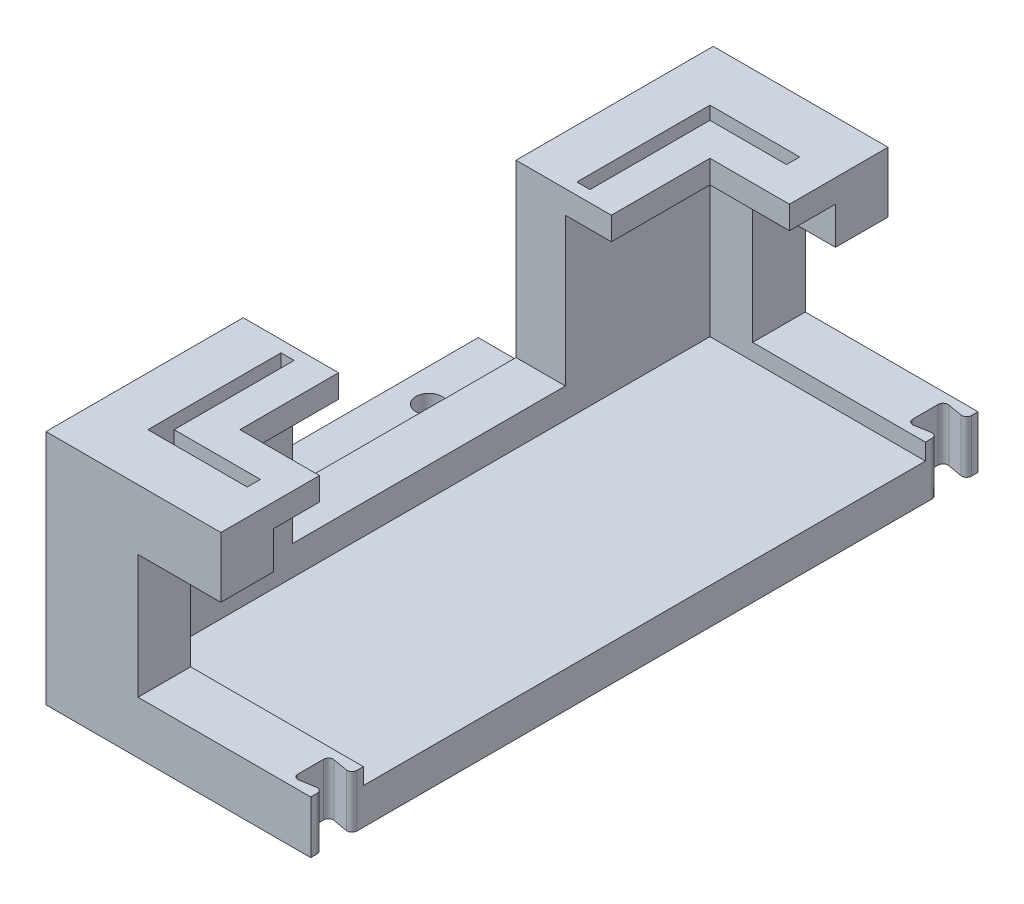
from build123d import *

# Parameters (mm, degrees)
SKETCH1_W                = 369
SKETCH1_H                = 203
BOSS_EXTRUDE1_DEPTH      = 20
SKETCH2_W                = 129
SKETCH2_H                = 16
BOSS_EXTRUDE2_DEPTH      = 12
SKETCH3_W                = 342
SKETCH3_H                = 171
CUT_EXTRUDE1_DEPTH       = 9
SKETCH4_W                = 100
SKETCH4_H                = 12
BOSS_EXTRUDE3_DEPTH      = 60
CUT_EXTRUDE3_START       = -60
CUT_EXTRUDE3_DEPTH       = 70
BOSS_EXTRUDE5_DEPTH      = 40
EXTRUDE_THIN1_DEPTH      = 7
SKETCH10_W               = 404
SKETCH10_H               = 324.796202869
CUT_EXTRUDE4_DEPTH       = 69
CUT_EXTRUDE7_DEPTH       = 284.607563369
CUT_EXTRUDE7_DEPTH_BACK  = 284.607563369
SKETCH14_W               = 37
SKETCH14_H               = 34.717467541
SKETCH12_W               = 50
SKETCH12_H               = 11
BOSS_EXTRUDE6_DEPTH      = 20
SKETCH13_R               = 4
CUT_EXTRUDE6_DEPTH       = 237.312293375
CUT_EXTRUDE9_DEPTH       = 235.150592568
SKETCH16_W               = 11.814467108
SKETCH16_H               = 18.387579902
CUT_EXTRUDE10_DEPTH      = 298.007154796
BOSS_EXTRUDE8_START      = -7
SKETCH18_W               = 7.945182936
SKETCH18_H               = 20.540998505
BOSS_EXTRUDE8_DEPTH      = 7
BOSS_EXTRUDE9_START      = -7
SKETCH19_W               = 10.87781478
SKETCH19_H               = 4
BOSS_EXTRUDE9_DEPTH      = 7
FILLET1_R                = 1.5
CUT_EXTRUDE11_DEPTH      = 298.007154796
CUT_EXTRUDE11_DEPTH_BACK = 298.007154796
SKETCH20_W               = 10
SKETCH20_H               = 2.9
SKETCH21_W               = 8.352928008
SKETCH21_H               = 52
SKETCH21_W_2             = 6.5
CUT_EXTRUDE12_DEPTH      = 149.238161416
SKETCH22_W               = 43.183103185
SKETCH22_H               = 12.42943685
CUT_EXTRUDE13_DEPTH      = 298.007154796


with BuildPart() as part:
    # Sketch1 → Boss-Extrude1 (new body)
    with BuildSketch(Plane(origin=(0, 0, 0), x_dir=(1, 0, 0), z_dir=(0, 1, 0))):
        Rectangle(SKETCH1_W, SKETCH1_H)
    extrude(amount=BOSS_EXTRUDE1_DEPTH)

    # Sketch2 → Boss-Extrude2 (add)
    with BuildSketch(Plane(origin=(0, 20, 0), x_dir=(1, 0, 0), z_dir=(0, 1, 0))):
        Polygon((-184.5, -101.5), (-169.5, -101.5), (-119.5, -101.5), (-119.5, -85.5), (-169.5, -85.5), (-169.5, -36.5), (-184.5, -36.5), align=None)
        Polygon((-184.5, 101.5), (-169.5, 101.5), (-119.5, 101.5), (-119.5, 85.5), (-169.5, 85.5), (-169.5, 36.5), (-184.5, 36.5), align=None)
        with Locations((20, -93.5)):
            Rectangle(SKETCH2_W, SKETCH2_H)
        with Locations((20, 93.5)):
            Rectangle(SKETCH2_W, SKETCH2_H)
    extrude(amount=BOSS_EXTRUDE2_DEPTH)

    # Sketch3 → Cut-Extrude1 (cut)
    with BuildSketch(Plane(origin=(0, 20, 0), x_dir=(1, 0, 0), z_dir=(0, 1, 0))):
        with Locations((1.5, 0)):
            Rectangle(SKETCH3_W, SKETCH3_H)
    extrude(amount=-CUT_EXTRUDE1_DEPTH, mode=Mode.SUBTRACT)

    # Sketch4 → Boss-Extrude3 (add)
    with BuildSketch(Plane(origin=(0, 0, -101.5), x_dir=(-1, 0, 0), z_dir=(0, 0, -1))):
        with Locations((-19.5, 26)):
            Rectangle(SKETCH4_W, SKETCH4_H)
    boss_extrude3 = extrude(amount=BOSS_EXTRUDE3_DEPTH)

    # Sketch6 → Cut-Extrude3 (cut)
    with BuildSketch(Plane.XY.offset(-85.5).offset(CUT_EXTRUDE3_START)):
        with BuildLine():
            Line((-24.5, 32), (-26.787099163, 29.101539441))
            ThreePointArc((-26.787099163, 29.101539441), (-26.9948908, 27.190971116), (-25.366310671, 26.170591063))
            Line((-25.366310671, 26.170591063), (-15.633690062, 26.170591063))
            ThreePointArc((-15.633690062, 26.170591063), (-14.00510936, 27.190970786), (-14.212900837, 29.101539441))
            Line((-14.212900837, 29.101539441), (-16.5, 32))
            Line((-16.5, 32), (-24.5, 32))
        make_face()
        with BuildLine():
            Line((56.5, 32), (54.250139337, 28.697067806))
            ThreePointArc((54.250139337, 28.697067806), (54.153814675, 26.972097696), (55.633689937, 26.080599221))
            Line((55.633689937, 26.080599221), (65.366310546, 26.080599221))
            ThreePointArc((65.366310546, 26.080599221), (66.846185438, 26.972097909), (66.749860663, 28.697067806))
            Line((66.749860663, 28.697067806), (64.5, 32))
            Line((64.5, 32), (56.5, 32))
        make_face()
    cut_extrude3 = extrude(amount=CUT_EXTRUDE3_DEPTH, mode=Mode.SUBTRACT)

    # Sketch8 → Boss-Extrude5 (add)
    with BuildSketch(Plane(origin=(0, 32, 0), x_dir=(1, 0, 0), z_dir=(0, 1, 0))):
        Polygon((-184.5, 36.5), (-169.5, 36.5), (-169.5, 85.5), (-119.5, 85.5), (-119.5, 101.5), (-184.5, 101.5), align=None)
    boss_extrude5 = extrude(amount=BOSS_EXTRUDE5_DEPTH)

    # Sketch9 → Extrude-Thin1 (add)
    with BuildSketch(Plane(origin=(0, 72, 0), x_dir=(1, 0, 0), z_dir=(0, 1, 0))):
        Polygon((-119.5, 85.5), (-119.5, 71.5), (-155.5, 71.5), (-155.5, 35), (-169.5, 35), (-169.5, 45), (-165.5, 45), (-165.5, 81.5), (-129.5, 81.5), (-129.5, 85.5), align=None)
    extrude_thin1 = extrude(amount=-EXTRUDE_THIN1_DEPTH)

    # Mirror2: Boss-Extrude3, Cut-Extrude3, Boss-Extrude5, Extrude-Thin1 across plane
    add(boss_extrude3.mirror(Plane.XY))
    add(cut_extrude3.mirror(Plane.XY), mode=Mode.SUBTRACT)
    add(boss_extrude5.mirror(Plane.XY))
    add(extrude_thin1.mirror(Plane.XY))

    # Sketch10 → Cut-Extrude4 (cut)
    with BuildSketch(Plane(origin=(0, 32, 0), x_dir=(1, 0, 0), z_dir=(0, 1, 0))):
        with Locations((98.05, -0.89352463)):
            Rectangle(SKETCH10_W, SKETCH10_H)
    extrude(amount=-CUT_EXTRUDE4_DEPTH, mode=Mode.SUBTRACT)

    # Sketch14 → Cut-Extrude7 (cut, two sides: drawn at the far end of the back side and taken through both)
    with BuildSketch(Plane(origin=(0, 0, -101.5), x_dir=(-1, 0, 0), z_dir=(0, 0, -1)).offset(-CUT_EXTRUDE7_DEPTH_BACK)):
        with Locations((138, 36.253686327)):
            Rectangle(SKETCH14_W, SKETCH14_H)
    extrude(amount=CUT_EXTRUDE7_DEPTH + CUT_EXTRUDE7_DEPTH_BACK, mode=Mode.SUBTRACT)

    # Sketch12 → Boss-Extrude6 (add)
    with BuildSketch(Plane.ZY.offset(184.5)):
        with Locations((-25, 5.5)):
            Rectangle(SKETCH12_W, SKETCH12_H)
    boss_extrude6 = extrude(amount=BOSS_EXTRUDE6_DEPTH)

    # Sketch13 → Cut-Extrude6 (cut, through all)
    with BuildSketch(Plane(origin=(0, 11, 0), x_dir=(1, 0, 0), z_dir=(0, 1, 0))):
        with Locations(Location((-194.5, 25, 0), (0, 0, 270))):
            Circle(SKETCH13_R)
    cut_extrude6 = extrude(amount=-CUT_EXTRUDE6_DEPTH, mode=Mode.SUBTRACT)

    # Mirror3: Boss-Extrude6, Cut-Extrude6 across plane
    add(boss_extrude6.mirror(Plane.XY))
    add(cut_extrude6.mirror(Plane.XY), mode=Mode.SUBTRACT)

    # Sketch11 → Cut-Extrude9 (cut, through all)
    with BuildSketch(Plane(origin=(0, 20, 0), x_dir=(1, 0, 0), z_dir=(0, 1, 0))):
        Polygon((-103.95, 97.75), (-103.95, 89.25), (-111.95, 87.839384154), (-111.95, 99.160615846), align=None)
        Polygon((-103.95, -89.25), (-103.95, -97.75), (-111.95, -99.160615846), (-111.95, -87.839384154), align=None)
    extrude(amount=-CUT_EXTRUDE9_DEPTH, mode=Mode.SUBTRACT)

    # Sketch16 → Cut-Extrude10 (cut, through all)
    with BuildSketch(Plane.XY.offset(101.5)):
        with Locations((-125.407233554, 62.806210049)):
            Rectangle(SKETCH16_W, SKETCH16_H)
    extrude(amount=-CUT_EXTRUDE10_DEPTH, mode=Mode.SUBTRACT)

    # Sketch18 → Boss-Extrude8 (add)
    with BuildSketch(Plane(origin=(0, 72, 0), x_dir=(1, 0, 0), z_dir=(0, 1, 0)).offset(BOSS_EXTRUDE8_START)):
        with Locations((-135.287058576, -81.770499253)):
            Rectangle(SKETCH18_W, SKETCH18_H)
    extrude(amount=BOSS_EXTRUDE8_DEPTH)

    # Sketch19 → Boss-Extrude9 (add)
    with BuildSketch(Plane(origin=(0, 72, 0), x_dir=(1, 0, 0), z_dir=(0, 1, 0)).offset(BOSS_EXTRUDE9_START)):
        with Locations((-136.753374498, 83.5)):
            Rectangle(SKETCH19_W, SKETCH19_H)
    extrude(amount=BOSS_EXTRUDE9_DEPTH)

    # Fillet1
    fillet1_edges = [part.edges().sort_by_distance(p)[0] for p in [
        (-111.95, 10, -99.160615846),
        (-103.95, 10, -97.75),
        (-103.95, 10, -89.25),
        (-111.95, 10, -87.839384154),
        (-111.95, 10, 99.160615846),
        (-111.95, 10, 87.839384154),
        (-103.95, 10, 89.25),
        (-103.95, 10, 97.75),
    ]]
    fillet(fillet1_edges, radius=FILLET1_R)

    # Sketch20 → Cut-Extrude11 (cut, two sides: drawn at the far end of the back side and taken through both)
    with BuildSketch(Plane.XY.offset(101.5).offset(-CUT_EXTRUDE11_DEPTH_BACK)):
        with Locations((-151.5, 17.444952557)):
            Rectangle(SKETCH20_W, SKETCH20_H)
    extrude(amount=CUT_EXTRUDE11_DEPTH + CUT_EXTRUDE11_DEPTH_BACK, mode=Mode.SUBTRACT)

    # Sketch21 → Cut-Extrude12 (cut, through all)
    with BuildSketch(Plane.ZY.offset(184.5)):
        with Locations((-37.323535996, 46)):
            Rectangle(SKETCH21_W, SKETCH21_H)
        with Locations((38.25, 46)):
            Rectangle(SKETCH21_W_2, SKETCH21_H)
    extrude(amount=-CUT_EXTRUDE12_DEPTH, mode=Mode.SUBTRACT)

    # Sketch22 → Cut-Extrude13 (cut, through all)
    with BuildSketch(Plane.XY.offset(101.5)):
        with Locations((-124.908448408, 22.209670982)):
            Rectangle(SKETCH22_W, SKETCH22_H)
    extrude(amount=-CUT_EXTRUDE13_DEPTH, mode=Mode.SUBTRACT)


solid = part.part
